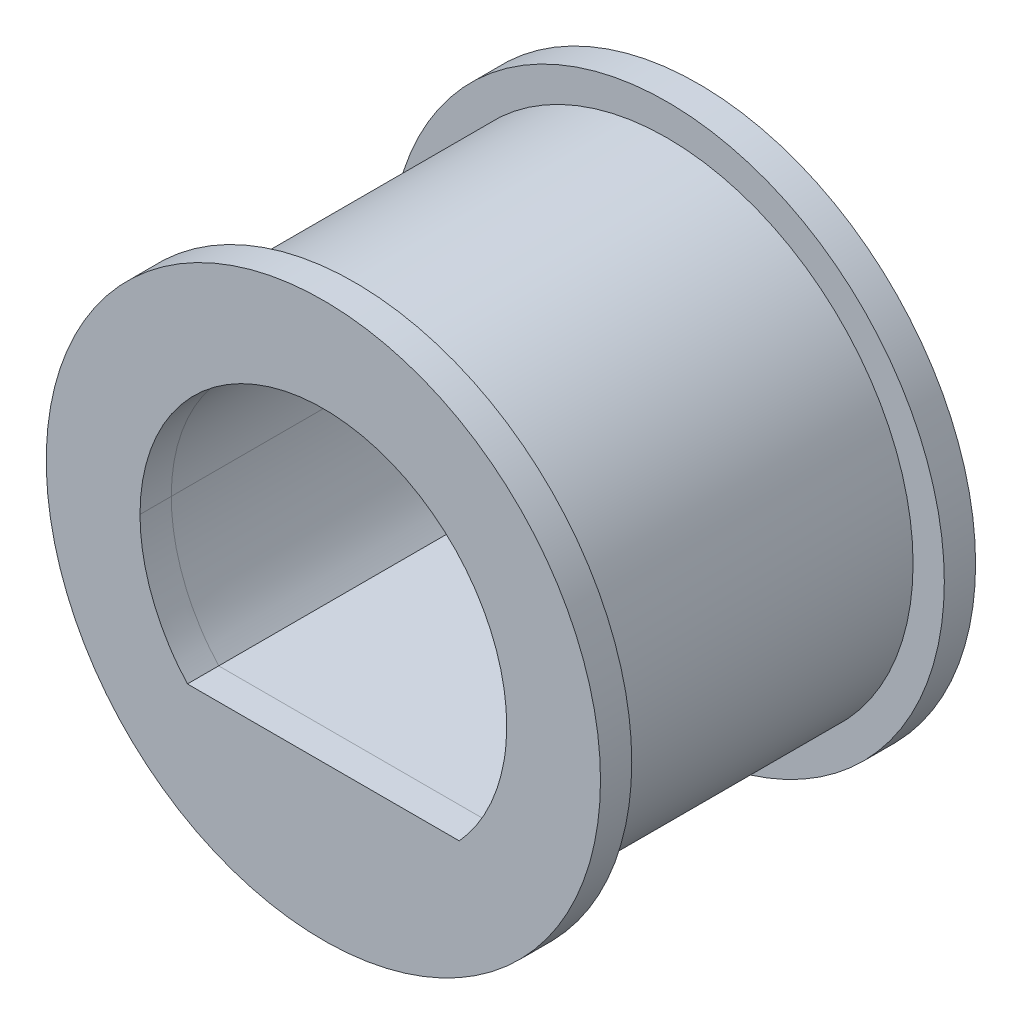
from build123d import *

# Parameters (mm, degrees)
SKETCH1_R           = 1.997999999
BOSS_EXTRUDE1_DEPTH = 1.27
BOSS_EXTRUDE2_START = 1.27
SKETCH1_5_R         = 2.251999999
BOSS_EXTRUDE2_DEPTH = 0.254


with BuildPart() as part:
    # Sketch1 → Boss-Extrude1 (new, symmetric)
    with BuildSketch(Plane.XY):
        with Locations((-14.585173992, 6.361392546)):
            Circle(SKETCH1_R)
        with BuildLine():
            Line((-13.480592623, 5.361392545), (-15.689755361, 5.361392545))
            add(Edge.make_bspline(
                [(-16.075173991, 6.361392546), (-16.074638254, 6.330921531), (-16.073567789, 6.270036937), (-16.064859774, 6.179022479), (-16.04865674, 6.073679037), (-16.020862372, 5.954905457), (-15.977427672, 5.824797796), (-15.922333529, 5.699149352), (-15.85569141, 5.579296345), (-15.779043389, 5.46540879), (-15.719518037, 5.396064627), (-15.689755361, 5.361392545)],
                knots=[0, 0, 0, 0, 0.083397986, 0.166638774, 0.25003676, 0.375030634, 0.500024507, 0.62501838, 0.750012253, 0.875006126, 1, 1, 1, 1], degree=3))
            ThreePointArc((-16.075173991, 6.361392546), (-14.585173992, 7.851392545), (-13.095173993, 6.361392546))
            add(Edge.make_bspline(
                [(-13.480592623, 5.361392545), (-13.460539436, 5.384341171), (-13.420470859, 5.430195167), (-13.365842841, 5.503511201), (-13.307154336, 5.59247995), (-13.248045319, 5.69918428), (-13.192924177, 5.824787769), (-13.14943929, 5.954910636), (-13.118404819, 6.088487495), (-13.098791679, 6.224357356), (-13.096379888, 6.315714149), (-13.095173993, 6.361392546)],
                knots=[0, 0, 0, 0, 0.083397986, 0.166638776, 0.250036761, 0.375030634, 0.500024507, 0.62501838, 0.750012254, 0.875006127, 1, 1, 1, 1], degree=3))
        make_face(mode=Mode.SUBTRACT)
    extrude(amount=BOSS_EXTRUDE1_DEPTH, both=True)


with BuildPart() as body_2:
    # Sketch1<5> → Boss-Extrude2 (new body)
    with BuildSketch(Plane.XY.offset(BOSS_EXTRUDE2_START)):
        with Locations((-14.585173992, 6.361392546)):
            Circle(SKETCH1_5_R)
        with BuildLine():
            Line((-13.480592623, 5.361392545), (-15.689755361, 5.361392545))
            add(Edge.make_bspline(
                [(-16.075173991, 6.361392546), (-16.074638254, 6.330921531), (-16.073567789, 6.270036937), (-16.064859774, 6.179022479), (-16.04865674, 6.073679037), (-16.020862372, 5.954905457), (-15.977427672, 5.824797796), (-15.922333529, 5.699149352), (-15.85569141, 5.579296345), (-15.779043389, 5.46540879), (-15.719518037, 5.396064627), (-15.689755361, 5.361392545)],
                knots=[0, 0, 0, 0, 0.083397986, 0.166638774, 0.25003676, 0.375030634, 0.500024507, 0.62501838, 0.750012253, 0.875006126, 1, 1, 1, 1], degree=3))
            ThreePointArc((-16.075173991, 6.361392546), (-14.585173992, 7.851392545), (-13.095173993, 6.361392546))
            add(Edge.make_bspline(
                [(-13.480592623, 5.361392545), (-13.460539436, 5.384341171), (-13.420470859, 5.430195167), (-13.365842841, 5.503511201), (-13.307154336, 5.59247995), (-13.248045319, 5.69918428), (-13.192924177, 5.824787769), (-13.14943929, 5.954910636), (-13.118404819, 6.088487495), (-13.098791679, 6.224357356), (-13.096379888, 6.315714149), (-13.095173993, 6.361392546)],
                knots=[0, 0, 0, 0, 0.083397986, 0.166638776, 0.250036761, 0.375030634, 0.500024507, 0.62501838, 0.750012254, 0.875006127, 1, 1, 1, 1], degree=3))
        make_face(mode=Mode.SUBTRACT)
    extrude(amount=BOSS_EXTRUDE2_DEPTH)


with BuildPart() as body_3:
    # Mirror2: mirrored copy
    add(body_2.part.mirror(Plane.XY))


solid = Compound([part.part, body_2.part, body_3.part])
